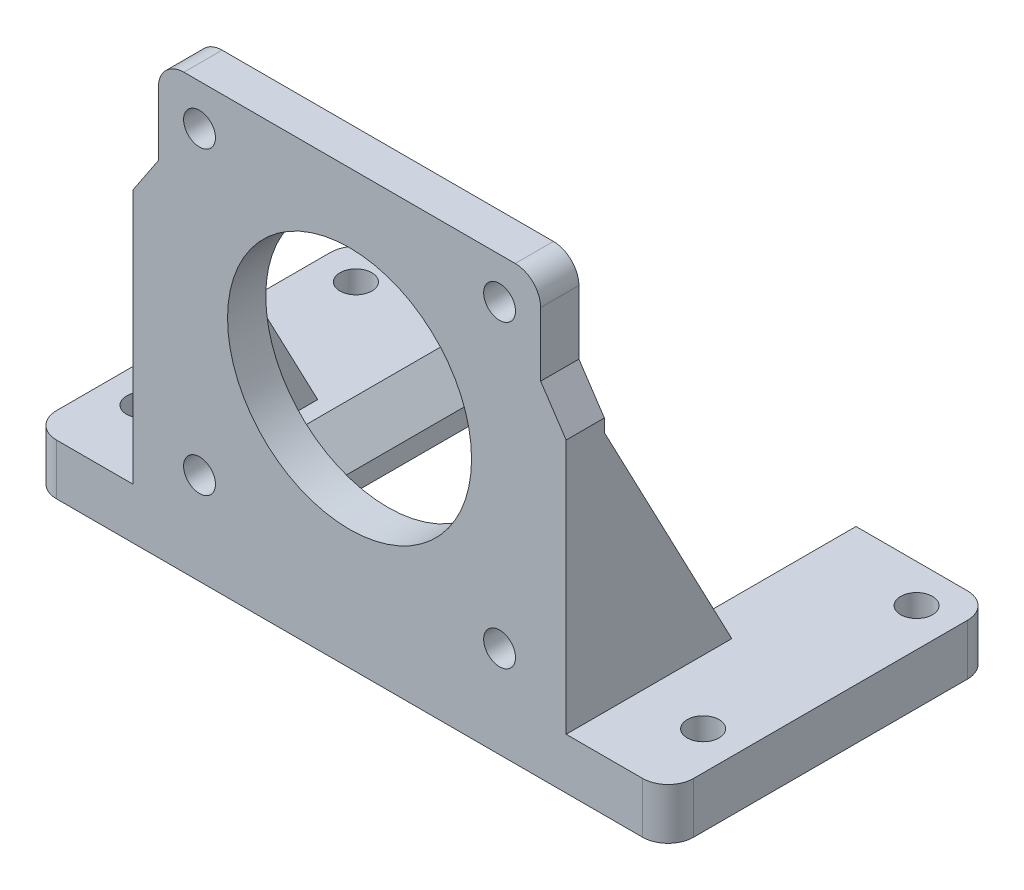
from build123d import *

# Parameters (mm, degrees)
SKETCH_1_W          = 60
SKETCH_1_H          = 60
EXTRUDE_1_DEPTH     = 6
SKETCH_2_R          = 19.15
CUT_EXTRUDE_1_DEPTH = 6
SKETCH_3_R          = 2.5
CUT_EXTRUDE_2_DEPTH = 6
SKETCH_4_W          = 60
SKETCH_4_H          = 6
EXTRUDE_2_DEPTH     = 8
SKETCH_5_W          = 60
SKETCH_5_H          = 8
EXTRUDE_3_DEPTH     = 45
SKETCH_6_W          = 51
SKETCH_6_H          = 8
EXTRUDE_4_DEPTH     = 20
SKETCH_7_W          = 51
SKETCH_7_H          = 8
EXTRUDE_5_DEPTH     = 20
EXTRUDE_6_DEPTH     = 6
EXTRUDE_8_DEPTH     = 6
EXTRUDE_10_DEPTH    = 2
EXTRUDE_11_DEPTH    = 2
EXTRUDE_12_DEPTH    = 1
EXTRUDE_13_DEPTH    = 1
SKETCH_14_W         = 35
SKETCH_14_H         = 59.55119734
CUT_EXTRUDE_3_DEPTH = 10
SKETCH_15_R         = 2.5
CUT_EXTRUDE_4_DEPTH = 10
SKETCH_16_W         = 35
SKETCH_16_H         = 8
CUT_EXTRUDE_6_DEPTH = 6
SKETCH_17_W         = 35
SKETCH_17_H         = 8
CUT_EXTRUDE_7_DEPTH = 6
CHAMFER_3_SIZE      = 5
CHAMFER_4_SIZE      = 5
FILLET_2_R          = 4
FILLET_3_R          = 4
FILLET_4_R          = 4
FILLET_5_R          = 4
FILLET_6_R          = 4
FILLET_7_R          = 4


with BuildPart() as part:
    # 草图1 → 凸台-拉伸1 (new body)
    with BuildSketch(Plane.XY):
        Rectangle(SKETCH_1_W, SKETCH_1_H)
    extrude(amount=EXTRUDE_1_DEPTH)

    # 草图2 → 切除-拉伸1 (cut)
    with BuildSketch(Plane.XY.offset(6)):
        Circle(SKETCH_2_R)
    extrude(amount=-CUT_EXTRUDE_1_DEPTH, mode=Mode.SUBTRACT)

    # 草图3 → 切除-拉伸2 (cut)
    with BuildSketch(Plane.XY.offset(6)):
        with Locations((-23.55, 23.55)):
            Circle(SKETCH_3_R)
        with Locations((-23.55, -23.55)):
            Circle(SKETCH_3_R)
        with Locations((23.55, 23.55)):
            Circle(SKETCH_3_R)
        with Locations((23.55, -23.55)):
            Circle(SKETCH_3_R)
    extrude(amount=-CUT_EXTRUDE_2_DEPTH, mode=Mode.SUBTRACT)

    # 草图4 → 凸台-拉伸2 (add)
    with BuildSketch(Plane.XZ.offset(30)):
        with Locations((0, 3)):
            Rectangle(SKETCH_4_W, SKETCH_4_H)
    extrude(amount=EXTRUDE_2_DEPTH)

    # 草图5 → 凸台-拉伸3 (add)
    with BuildSketch(Plane(origin=(0, 0, 0), x_dir=(-1, 0, 0), z_dir=(0, 0, -1))):
        with Locations((0, -34)):
            Rectangle(SKETCH_5_W, SKETCH_5_H)
    extrude(amount=EXTRUDE_3_DEPTH)

    # 草图6 → 凸台-拉伸4 (add)
    with BuildSketch(Plane(origin=(30, 0, 0), x_dir=(0, 0, -1), z_dir=(1, 0, 0))):
        with Locations((19.5, -34)):
            Rectangle(SKETCH_6_W, SKETCH_6_H)
    extrude(amount=EXTRUDE_4_DEPTH)

    # 草图7 → 凸台-拉伸5 (add)
    with BuildSketch(Plane.ZY.offset(30)):
        with Locations((-19.5, -34)):
            Rectangle(SKETCH_7_W, SKETCH_7_H)
    extrude(amount=EXTRUDE_5_DEPTH)

    # 草图8 → 凸台-拉伸6 (add)
    with BuildSketch(Plane(origin=(0, 0, 0), x_dir=(-1, 0, 0), z_dir=(0, 0, -1))):
        Polygon((-30, -30), (-34, -30), (-34, 10), (-30, 16), align=None)
    extrude(amount=-EXTRUDE_6_DEPTH)

    # 草图9 → 凸台-拉伸8 (add)
    with BuildSketch(Plane(origin=(0, 0, 0), x_dir=(-1, 0, 0), z_dir=(0, 0, -1))):
        Polygon((30, -30), (34, -30), (34, 10), (30, 16), align=None)
    extrude(amount=-EXTRUDE_8_DEPTH)

    # 草图10 → 凸台-拉伸10 (add)
    with BuildSketch(Plane(origin=(34, 0, 0), x_dir=(0, 0, -1), z_dir=(1, 0, 0))):
        Polygon((0, -30), (20, -30), (0, 8), align=None)
    extrude(amount=-EXTRUDE_10_DEPTH)

    # 草图11 → 凸台-拉伸11 (add)
    with BuildSketch(Plane.ZY.offset(34)):
        Polygon((0, -30), (-20, -30), (0, 8), (0, 0), align=None)
    extrude(amount=-EXTRUDE_11_DEPTH)

    # 草图12 → 凸台-拉伸12 (add)
    with BuildSketch(Plane.ZY.offset(-32)):
        Polygon((-20, -30), (0, -30), (0, 8), align=None)
    extrude(amount=EXTRUDE_12_DEPTH)

    # 草图13 → 凸台-拉伸13 (add)
    with BuildSketch(Plane(origin=(-32, 0, 0), x_dir=(0, 0, -1), z_dir=(1, 0, 0))):
        Polygon((0, 8), (0, -30), (20, -30), align=None)
    extrude(amount=EXTRUDE_13_DEPTH)

    # 草图14 → 切除-拉伸3 (cut)
    with BuildSketch(Plane(origin=(0, -30, 0), x_dir=(1, 0, 0), z_dir=(0, 1, 0))):
        with Locations((0, 39.77559867)):
            Rectangle(SKETCH_14_W, SKETCH_14_H)
    extrude(amount=-CUT_EXTRUDE_3_DEPTH, mode=Mode.SUBTRACT)

    # 草图15 → 切除-拉伸4 (cut)
    with BuildSketch(Plane(origin=(0, -30, 0), x_dir=(1, 0, 0), z_dir=(0, 1, 0))):
        with Locations(Location((-44, 39, 0), (0, 0, 180))):
            Circle(SKETCH_15_R)
        with Locations(Location((-44, 5.5, 0), (0, 0, 180))):
            Circle(SKETCH_15_R)
        with Locations(Location((44, 5.5, 0), (0, 0, 180))):
            Circle(SKETCH_15_R)
        with Locations(Location((44, 39, 0), (0, 0, 180))):
            Circle(SKETCH_15_R)
    extrude(amount=-CUT_EXTRUDE_4_DEPTH, mode=Mode.SUBTRACT)

    # 草图16 → 切除-拉伸6 (cut)
    with BuildSketch(Plane.ZY.offset(-17.5)):
        with Locations((-27.5, -34)):
            Rectangle(SKETCH_16_W, SKETCH_16_H)
    extrude(amount=-CUT_EXTRUDE_6_DEPTH, mode=Mode.SUBTRACT)

    # 草图17 → 切除-拉伸7 (cut)
    with BuildSketch(Plane(origin=(-17.5, 0, 0), x_dir=(0, 0, -1), z_dir=(1, 0, 0))):
        with Locations((27.5, -34)):
            Rectangle(SKETCH_17_W, SKETCH_17_H)
    extrude(amount=-CUT_EXTRUDE_7_DEPTH, mode=Mode.SUBTRACT)

    # 倒角3
    chamfer_3_edges = [part.edges().sort_by_distance(p)[0] for p in [
        (23.5, -30, -27.5),
    ]]
    chamfer(chamfer_3_edges, length=CHAMFER_3_SIZE)

    # 倒角4
    chamfer_4_edges = [part.edges().sort_by_distance(p)[0] for p in [
        (-23.5, -30, -27.5),
    ]]
    chamfer(chamfer_4_edges, length=CHAMFER_4_SIZE)

    # 圆角2
    fillet_2_edges = [part.edges().sort_by_distance(p)[0] for p in [
        (30, 30, 3),
    ]]
    fillet(fillet_2_edges, radius=FILLET_2_R)

    # 圆角3
    fillet_3_edges = [part.edges().sort_by_distance(p)[0] for p in [
        (-30, 30, 3),
    ]]
    fillet(fillet_3_edges, radius=FILLET_3_R)

    # 圆角4
    fillet_4_edges = [part.edges().sort_by_distance(p)[0] for p in [
        (50, -34, -45),
    ]]
    fillet(fillet_4_edges, radius=FILLET_4_R)

    # 圆角5
    fillet_5_edges = [part.edges().sort_by_distance(p)[0] for p in [
        (-50, -34, -45),
    ]]
    fillet(fillet_5_edges, radius=FILLET_5_R)

    # 圆角6
    fillet_6_edges = [part.edges().sort_by_distance(p)[0] for p in [
        (-50, -34, 6),
    ]]
    fillet(fillet_6_edges, radius=FILLET_6_R)

    # 圆角7
    fillet_7_edges = [part.edges().sort_by_distance(p)[0] for p in [
        (50, -34, 6),
    ]]
    fillet(fillet_7_edges, radius=FILLET_7_R)


solid = part.part
